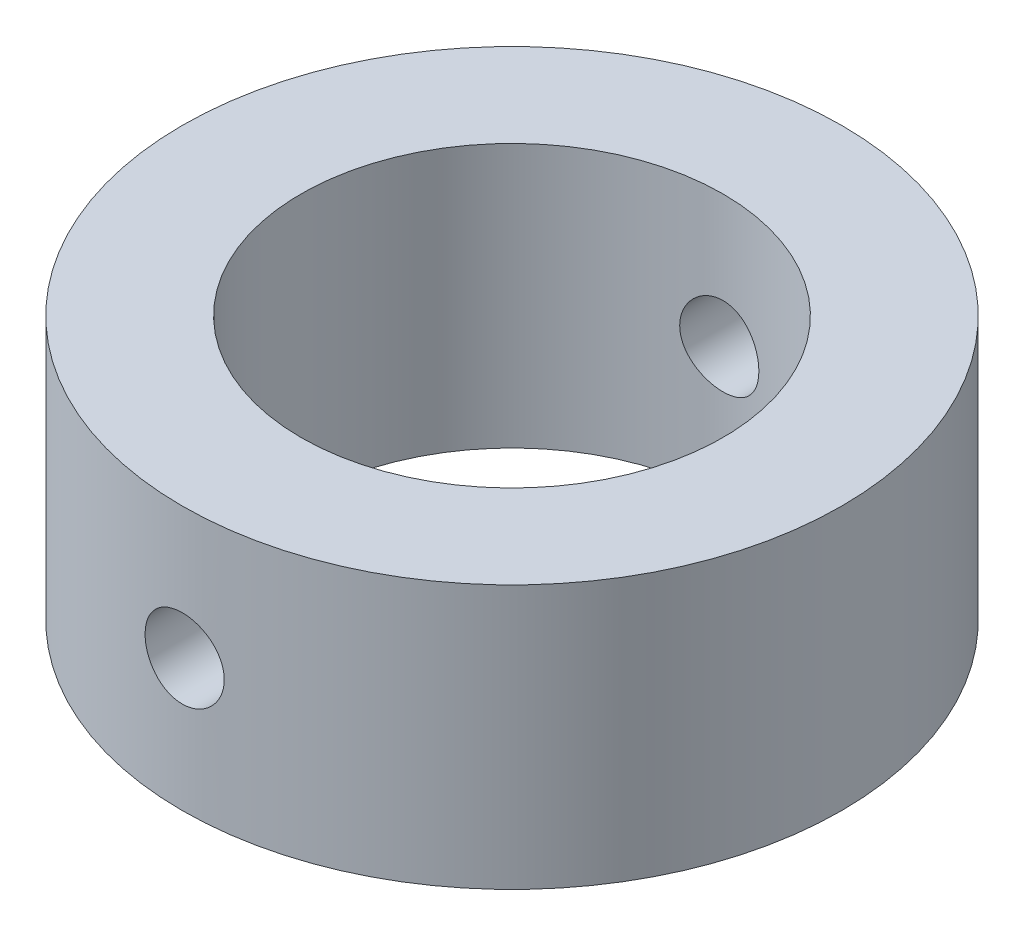
from build123d import *

# Parameters (mm, degrees)
SKETCH2_R               = 12.5
SKETCH2_R_2             = 8
BOSS_EXTRUDE1_DEPTH     = 10
CUT_EXTRUDE1_DEPTH      = 21.310096012
CUT_EXTRUDE1_DEPTH_BACK = 21.310096012
SKETCH3_R               = 1.5


with BuildPart() as part:
    # Sketch2 → Boss-Extrude1 (new body)
    with BuildSketch(Plane(origin=(0, 0, 0), x_dir=(1, 0, 0), z_dir=(0, 1, 0))):
        with Locations(Location((0, 0, 0), (0, 0, 270))):
            Circle(SKETCH2_R)
        with Locations(Location((0, 0, 0), (0, 0, 270))):
            Circle(SKETCH2_R_2, mode=Mode.SUBTRACT)
    extrude(amount=BOSS_EXTRUDE1_DEPTH)

    # Sketch3 → Cut-Extrude1 (cut, two sides: drawn at the far end of the back side and taken through both)
    with BuildSketch(Plane.XY.offset(-CUT_EXTRUDE1_DEPTH_BACK)):
        with Locations((0, 5)):
            Circle(SKETCH3_R)
    extrude(amount=CUT_EXTRUDE1_DEPTH + CUT_EXTRUDE1_DEPTH_BACK, mode=Mode.SUBTRACT)


solid = part.part
